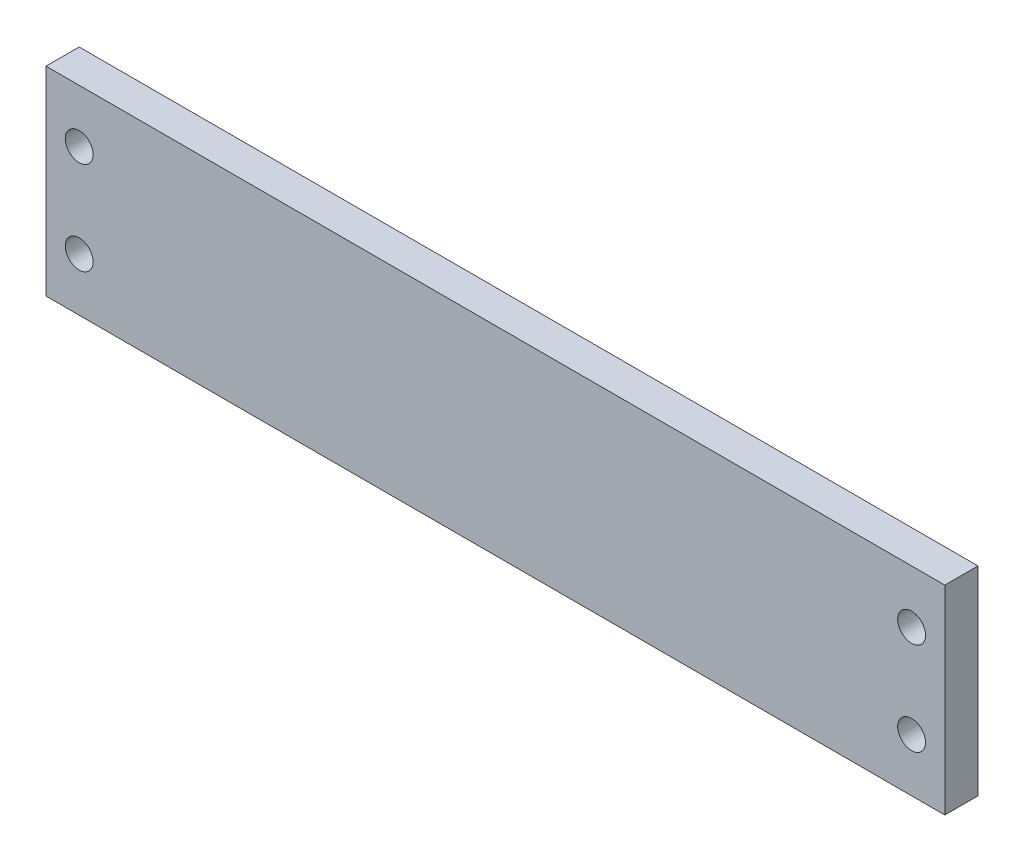
from build123d import *

# Parameters (mm, degrees)
ESQUISSE1_W        = 135.42
ESQUISSE1_H        = 30
ESQUISSE1_R        = 2.1
BOSS_EXTRU_1_DEPTH = 5


with BuildPart() as part:
    # Esquisse1 → Boss.-Extru.1 (new body)
    with BuildSketch(Plane.XY):
        with Locations((-67.71, 15)):
            Rectangle(ESQUISSE1_W, ESQUISSE1_H)
        with Locations((-5, 22)):
            Circle(ESQUISSE1_R, mode=Mode.SUBTRACT)
        with Locations((-130.42, 8)):
            Circle(ESQUISSE1_R, mode=Mode.SUBTRACT)
        with Locations((-5, 8)):
            Circle(ESQUISSE1_R, mode=Mode.SUBTRACT)
        with Locations((-130.42, 22)):
            Circle(ESQUISSE1_R, mode=Mode.SUBTRACT)
    extrude(amount=BOSS_EXTRU_1_DEPTH)


solid = part.part
